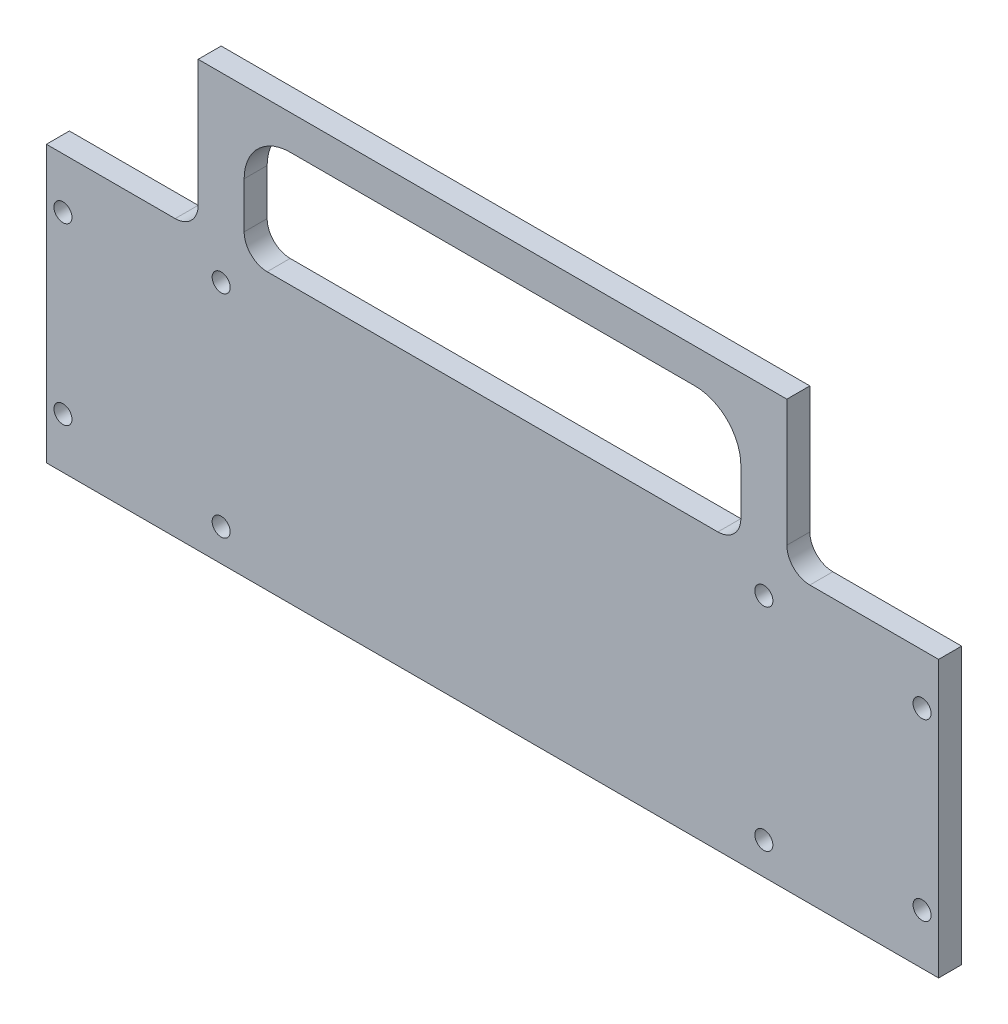
from build123d import *

# Parameters (mm, degrees)
SKETCH1_W              = 246.38
SKETCH1_H              = 76.2
BOSS_EXTRUDE1_DEPTH    = 6.35
F_10_CLEARANCE_HOLE1_D = 4.9784
BOSS_EXTRUDE2_DEPTH    = 6.35
FILLET1_R              = 12.7
FILLET1_OF_MIRROR1_R   = 12.7
FILLET2_R              = 6.35
FILLET3_R              = 6.35


with BuildPart() as part:
    # Sketch1 → Boss-Extrude1 (new body)
    with BuildSketch(Plane.XY):
        Rectangle(SKETCH1_W, SKETCH1_H)
    extrude(amount=BOSS_EXTRUDE1_DEPTH)

    # #10 Clearance Hole1 (through all)
    with Locations(Plane.XY.offset(6.35)):
        with Locations((-74.93, 29.21), (-74.93, -29.21), (74.93, 29.21), (74.93, -29.21), (-118.618, 24.13), (-118.618, -24.13), (118.618, 24.13), (118.618, -24.13)):
            Hole(F_10_CLEARANCE_HOLE1_D / 2)

    # Sketch5 → Boss-Extrude2 (add)
    with BuildSketch(Plane.XY.offset(6.35)):
        Polygon((-81.28, 47.271427301), (-81.28, 38.1), (-68.58, 38.1), (-68.58, 69.85), (-81.28, 69.85), align=None)
        Polygon((-81.28, 69.85), (-68.58, 69.85), (0, 69.85), (0, 79.375), (-81.28, 79.375), align=None)
    boss_extrude2 = extrude(amount=-BOSS_EXTRUDE2_DEPTH)

    # Fillet1
    fillet1_edges = [part.edges().sort_by_distance(p)[0] for p in [
        (-68.58, 69.85, 3.175),
    ]]
    fillet(fillet1_edges, radius=FILLET1_R)

    # Mirror1: Boss-Extrude2 across plane
    add(boss_extrude2.mirror(Plane(origin=(0, 0, 0), x_dir=(0, 0, 1), z_dir=(1, 0, 0))))

    # Fillet1 of Mirror1
    fillet1_of_mirror1_edges = [part.edges().sort_by_distance(p)[0] for p in [
        (68.58, 69.85, 3.175),
    ]]
    fillet(fillet1_of_mirror1_edges, radius=FILLET1_OF_MIRROR1_R)

    # Fillet2
    fillet2_edges = [part.edges().sort_by_distance(p)[0] for p in [
        (68.58, 38.1, 3.175),
        (-68.58, 38.1, 3.175),
    ]]
    fillet(fillet2_edges, radius=FILLET2_R)

    # Fillet3
    fillet3_edges = [part.edges().sort_by_distance(p)[0] for p in [
        (81.28, 38.1, 3.175),
        (-81.28, 38.1, 3.175),
    ]]
    fillet(fillet3_edges, radius=FILLET3_R)


solid = part.part
